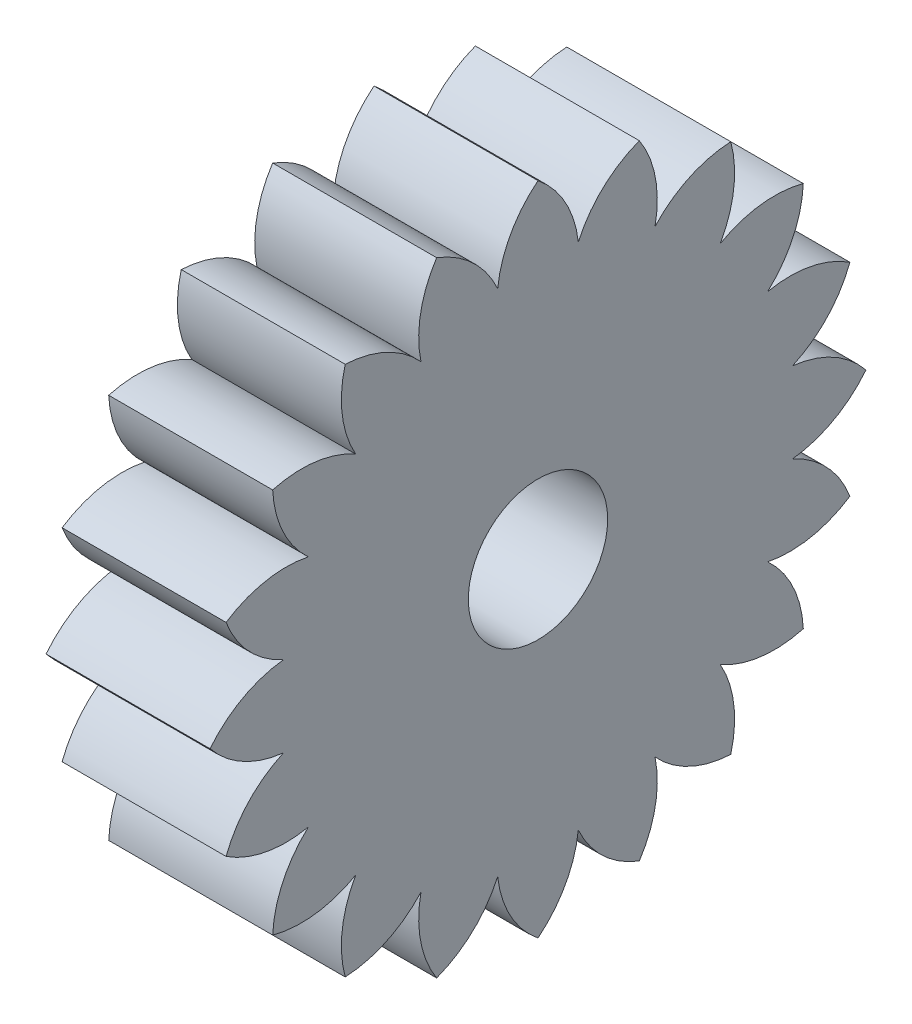
from build123d import *

# Parameters (mm, degrees)
EXTRUDE_1_DEPTH          = 6
PATTERN_CIRCULAR_1_COUNT = 20
SKETCH_2_R               = 2.55
CUT_EXTRUDE_1_DEPTH      = 19


with BuildPart() as part:
    # 스케치1 → 보스-돌출1 (new body)
    with BuildSketch(Plane(origin=(0, 0, 0), x_dir=(0, 0, -1), z_dir=(1, 0, 0))):
        with BuildLine():
            ThreePointArc((0, 12), (1.10558919, 10.60769458), (1.5, 8.874119675))
            ThreePointArc((1.5, 8.874119675), (0, -9), (-1.5, 8.874119675))
            ThreePointArc((-1.5, 8.874119675), (-1.10558919, 10.60769458), (0, 12))
        make_face()
    extrude_1 = extrude(amount=EXTRUDE_1_DEPTH)

    # 원형 패턴1: 보스-돌출1 ×20 about axis
    pattern_circular_1_axis = Axis((0, 0, 0), (1, 0, 0))
    for i in range(1, PATTERN_CIRCULAR_1_COUNT):
        add(extrude_1.rotate(pattern_circular_1_axis, i * 360 / PATTERN_CIRCULAR_1_COUNT))

    # 스케치2 → 컷-돌출1 (cut, through all)
    with BuildSketch(Plane(origin=(6, 0, 0), x_dir=(0, 0, -1), z_dir=(1, 0, 0))):
        Circle(SKETCH_2_R)
    extrude(amount=-CUT_EXTRUDE_1_DEPTH, mode=Mode.SUBTRACT)


solid = part.part
